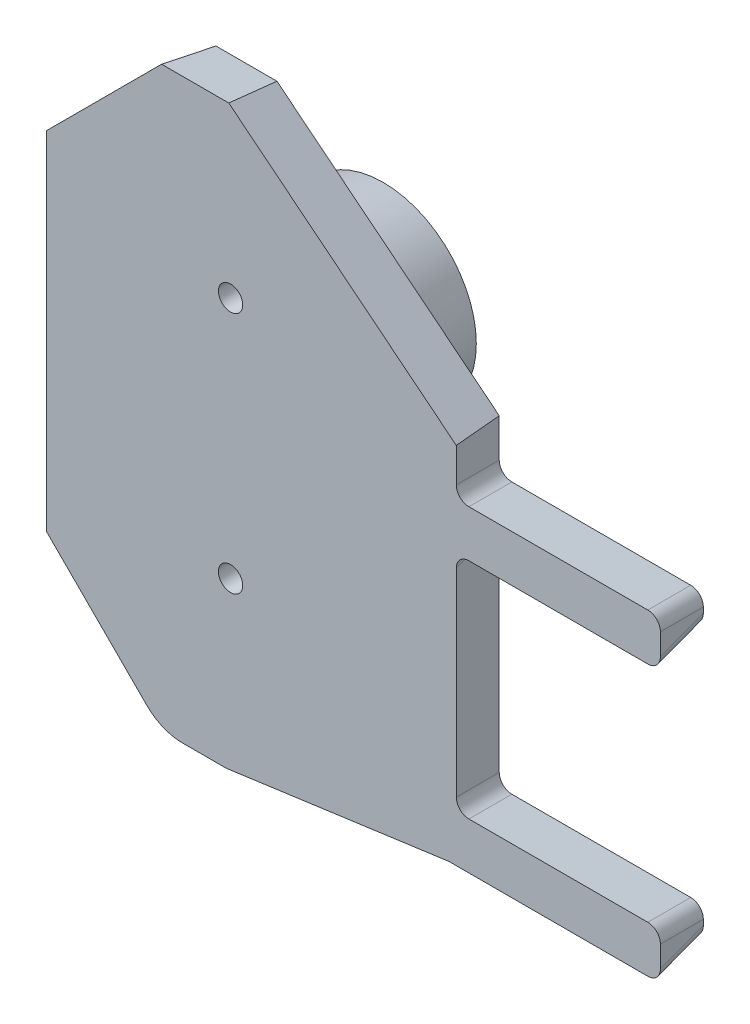
from build123d import *

# Parameters (mm, degrees)
RESSALTO_EXTRUS_O1_DEPTH = 10
RESSALTO_EXTRUS_O1_DRAFT = -9
ESBO_O2_R                = 23
RESSALTO_EXTRUS_O2_DEPTH = 30
RESSALTO_EXTRUS_O2_DRAFT = -9
FILETE1_R                = 10
FILETE2_R                = 2.5
ESCALA1_SCALE            = 1.05
ESBO_O3_R                = 2.5
CORTE_EXTRUS_O1_DEPTH    = 5


with BuildPart() as part:
    # Esboço1 → Ressalto-extrusão1 (with draft: the straight prism first)
    with BuildSketch(Plane.XY):
        Polygon((-22.781745931, 55), (-44.375431078, 33.406314852), (-44.375431078, -33.406314852), (-22.781745931, -55), (-10.825814677, -55), (32.742040246, -49), (72.742040246, -49), (72.742040246, -43), (32.742040246, -43), (32.742040246, 4), (72.742040246, 4), (72.742040246, 10), (32.742040246, 10), (32.742040246, 20), (-10.825814677, 55), align=None)
    extrude(amount=RESSALTO_EXTRUS_O1_DEPTH)
    # Ressalto-extrusão1: the draft: its side faces are tilted about the plane it starts from
    ressalto_extrus_o1_sides = [part.faces().sort_by_distance(p)[0] for p in [
        (-33.578588504, 44.203157426, 5),
        (-44.375431078, 0, 5),
        (-33.578588504, -44.203157426, 5),
        (-16.803780304, -55, 5),
        (10.958112785, -52, 5),
        (52.742040246, -49, 5),
        (72.742040246, -46, 5),
        (52.742040246, -43, 5),
        (32.742040246, -19.5, 5),
        (52.742040246, 4, 5),
        (72.742040246, 7, 5),
        (52.742040246, 10, 5),
        (32.742040246, 15, 5),
        (10.958112785, 37.5, 5),
        (-16.803780304, 55, 5),
    ]]
    draft(ressalto_extrus_o1_sides, Plane.XY, RESSALTO_EXTRUS_O1_DRAFT)


with BuildPart() as ressalto_extrus_o2_tool:
    # Esboço2 → Ressalto-extrusão2 (with draft: the straight prism first)
    with BuildSketch(Plane.XY):
        with Locations((-20, 0)):
            Circle(ESBO_O2_R)
    extrude(amount=-RESSALTO_EXTRUS_O2_DEPTH)
    # Ressalto-extrusão2: the draft: its side faces are tilted about the plane it starts from
    ressalto_extrus_o2_sides = [ressalto_extrus_o2_tool.faces().sort_by_distance(p)[0] for p in [
        (-43, 0, -15),
    ]]
    draft(ressalto_extrus_o2_sides, Plane.XY, RESSALTO_EXTRUS_O2_DRAFT)


with BuildPart() as part_1:
    add(part.part)

    # Ressalto-extrusão2: add ressalto_extrus_o2_tool
    add(ressalto_extrus_o2_tool.part)

    # Filete1
    filete1_edges = [part_1.edges().sort_by_distance(p)[0] for p in [
        (-23.109770847, -55.791922202, 5),
    ]]
    fillet(filete1_edges, radius=FILETE1_R)

    # Filete2
    filete2_edges = [part_1.edges().sort_by_distance(p)[0] for p in [
        (33.533962448, 10.791922202, 5),
        (73.533962448, 10.791922202, 5),
        (73.533962448, 3.208077798, 5),
        (33.533962448, 3.208077798, 5),
        (33.533962448, -42.208077798, 5),
        (73.533962448, -42.208077798, 5),
        (73.533962448, -49.791922202, 5),
    ]]
    fillet(filete2_edges, radius=FILETE2_R)


with BuildPart() as part_2:
    # Escala1: scaled about (-8.171649515, -3.224100795, -1.267383115)
    add(part_1.part.scale(ESCALA1_SCALE).moved(Location((0.408582476, 0.16120504, 0.063369156))))

    # Esboço3 → Corte-extrusão1 (cut)
    with BuildSketch(Plane.XY.offset(10.563369297)):
        with Locations((-10, 25)):
            Circle(ESBO_O3_R)
        with Locations((-10, -25)):
            Circle(ESBO_O3_R)
    extrude(amount=-CORTE_EXTRUS_O1_DEPTH, mode=Mode.SUBTRACT)


solid = part_2.part
